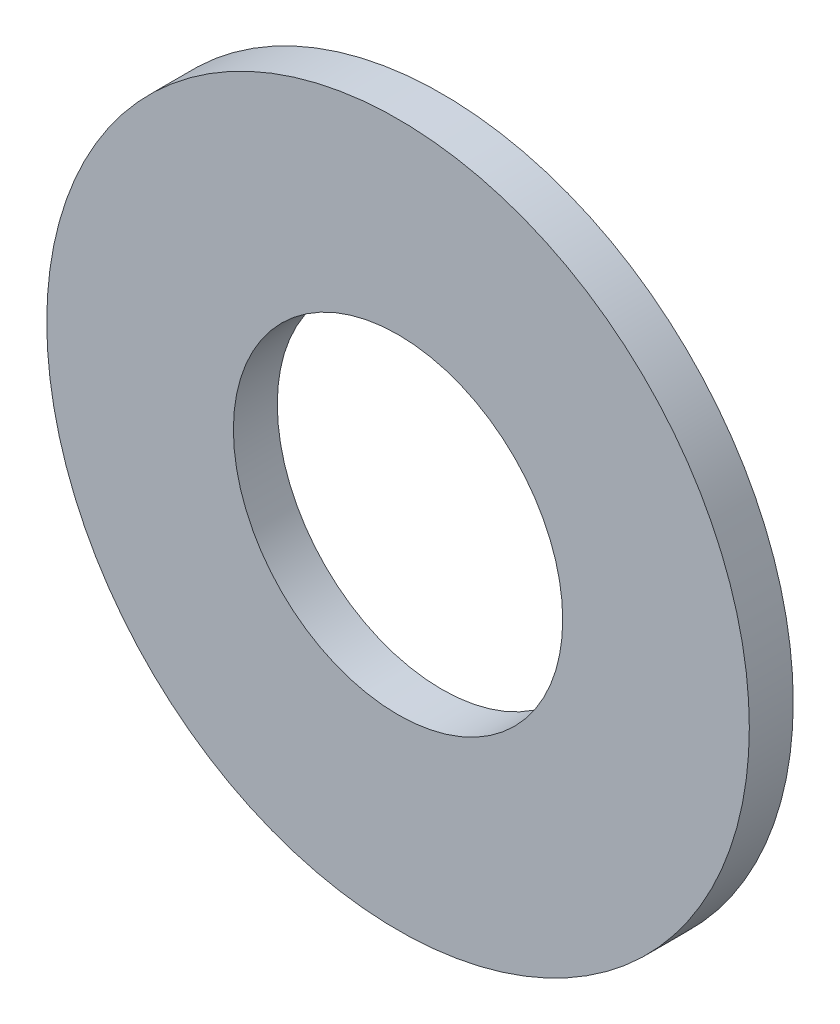
from build123d import *

# Parameters (mm, degrees)
SKETCH1_R           = 16
SKETCH1_R_2         = 7.5
BOSS_EXTRUDE1_DEPTH = 1


with BuildPart() as part:
    # Sketch1 → Boss-Extrude1 (new, symmetric)
    with BuildSketch(Plane.XY):
        Circle(SKETCH1_R)
        Circle(SKETCH1_R_2, mode=Mode.SUBTRACT)
    extrude(amount=BOSS_EXTRUDE1_DEPTH, both=True)


solid = part.part
